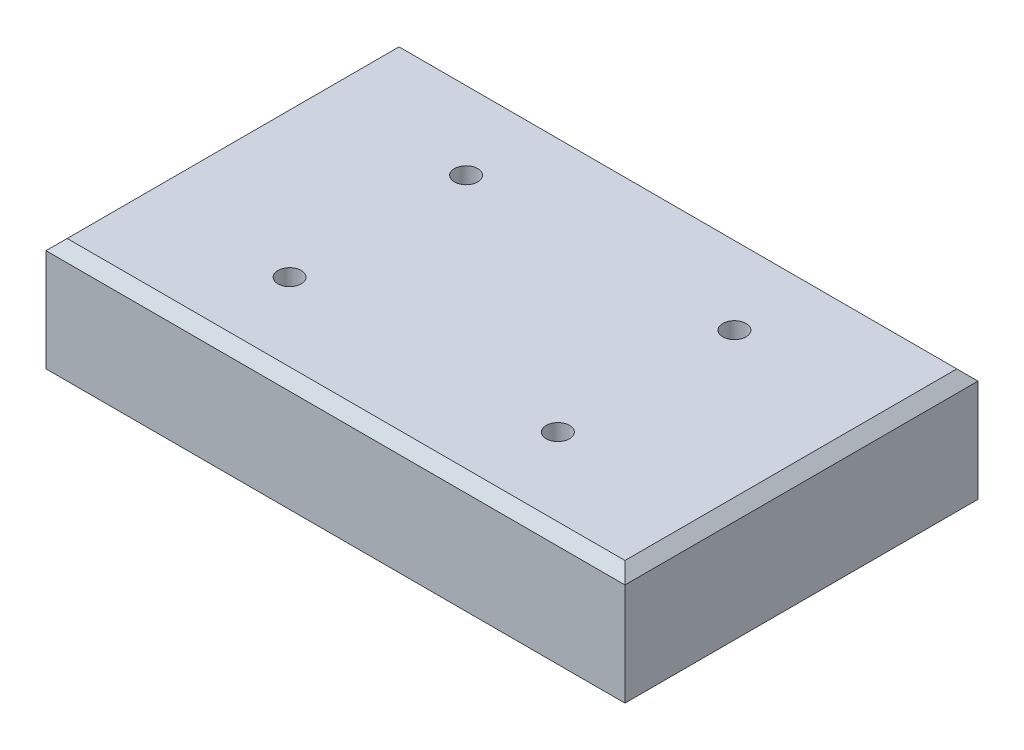
from build123d import *

# Parameters (mm, degrees)
SKETCH2_W             = 82
SKETCH2_H             = 50
BOSS_EXTRUDE1_DEPTH   = 16
M4_TAPPED_HOLE1_D     = 3.3
M4_TAPPED_HOLE1_DEPTH = 8
M4_TAPPED_HOLE1_TIP   = 0.991420021
CHAMFER1_SIZE         = 1.5


with BuildPart() as part:
    # Sketch2 → Boss-Extrude1 (new body)
    with BuildSketch(Plane(origin=(0, 0, 0), x_dir=(1, 0, 0), z_dir=(0, 1, 0))):
        Rectangle(SKETCH2_W, SKETCH2_H)
    extrude(amount=BOSS_EXTRUDE1_DEPTH)

    # M4 Tapped Hole1
    with Locations(Plane(origin=(0, 16, 0), x_dir=(1, 0, 0), z_dir=(0, 1, 0))):
        with Locations((-19, 12.5), (-19, -12.5), (19, -12.5), (19, 12.5)):
            Hole(M4_TAPPED_HOLE1_D / 2, depth=M4_TAPPED_HOLE1_DEPTH)
            with Locations((0, 0, -(M4_TAPPED_HOLE1_DEPTH + M4_TAPPED_HOLE1_TIP / 2))):  # 118° drill point
                Cone(0, M4_TAPPED_HOLE1_D / 2, M4_TAPPED_HOLE1_TIP, mode=Mode.SUBTRACT)

    # Chamfer1
    chamfer1_edges = [part.edges().sort_by_distance(p)[0] for p in [
        (-41, 16, 0),
        (0, 16, 25),
        (41, 16, 0),
        (0, 16, -25),
    ]]
    chamfer(chamfer1_edges, length=CHAMFER1_SIZE)


solid = part.part
